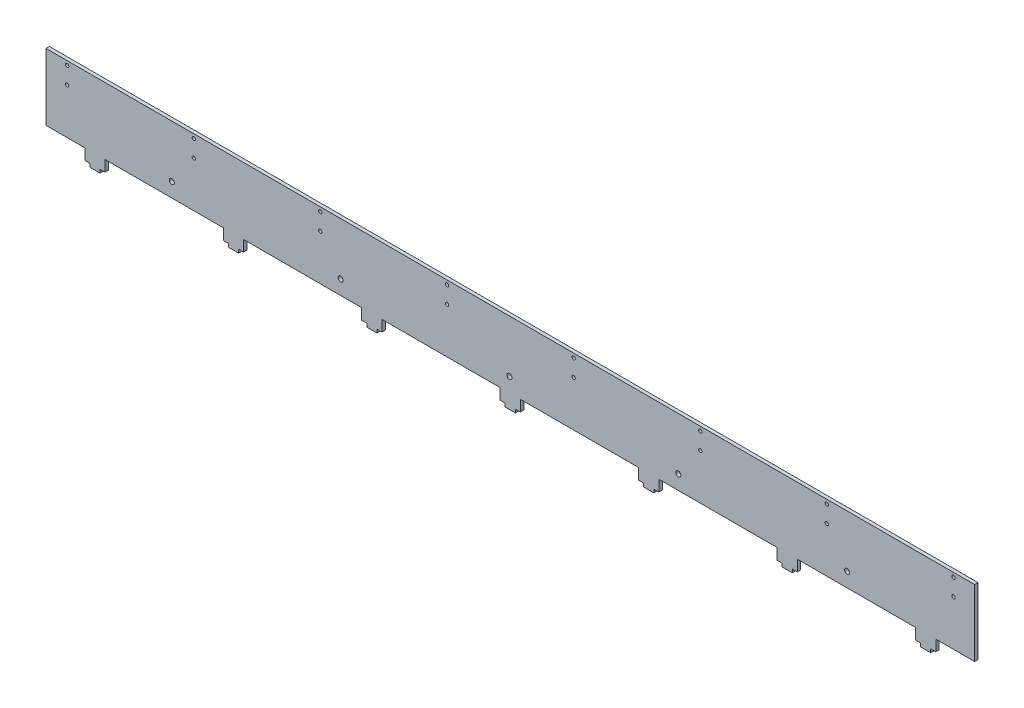
from build123d import *

# Parameters (mm, degrees)
SKETCH_1_W             = 1100
SKETCH_1_H             = 92
EXTRUDE_1_DEPTH        = 2
SKETCH_2_W             = 46
SKETCH_2_H             = 13
SKETCH_2_W_2           = 140
CUT_EXTRUDE_1_DEPTH    = 552.934778756
SKETCH_3_R             = 2
CUT_EXTRUDE_2_DEPTH    = 552.934778756
PATTERN_LINEAR_1_COUNT = 8
PATTERN_LINEAR_1_PITCH = 150
SKETCH_4_R             = 3
CUT_EXTRUDE_3_DEPTH    = 552.934778756
PATTERN_LINEAR_2_COUNT = 5
PATTERN_LINEAR_2_PITCH = 200
SKETCH_5_W             = 12
SKETCH_5_H             = 4
EXTRUDE_2_DEPTH        = 4


with BuildPart() as part:
    # Эскиз1 → Бобышка-Вытянуть1 (new, symmetric)
    with BuildSketch(Plane.XY):
        Rectangle(SKETCH_1_W, SKETCH_1_H)
    extrude(amount=EXTRUDE_1_DEPTH, both=True)

    # Эскиз2 → Вырез-Вытянуть1 (cut, through all)
    with BuildSketch(Plane.XY.offset(2)):
        with Locations((-527, -39.5)):
            Rectangle(SKETCH_2_W, SKETCH_2_H)
        with Locations((527, -39.5)):
            Rectangle(SKETCH_2_W, SKETCH_2_H)
        with Locations((-410, -39.5)):
            Rectangle(SKETCH_2_W_2, SKETCH_2_H)
        with Locations((-246, -39.5)):
            Rectangle(SKETCH_2_W_2, SKETCH_2_H)
        with Locations((-82, -39.5)):
            Rectangle(SKETCH_2_W_2, SKETCH_2_H)
        with Locations((82, -39.5)):
            Rectangle(SKETCH_2_W_2, SKETCH_2_H)
        with Locations((246, -39.5)):
            Rectangle(SKETCH_2_W_2, SKETCH_2_H)
        with Locations((410, -39.5)):
            Rectangle(SKETCH_2_W_2, SKETCH_2_H)
    extrude(amount=-CUT_EXTRUDE_1_DEPTH, mode=Mode.SUBTRACT)

    # Эскиз3 → Вырез-Вытянуть2 (cut, through all)
    with BuildSketch(Plane.XY.offset(2)):
        with Locations((-525, 41)):
            Circle(SKETCH_3_R)
        with Locations((-525, 21)):
            Circle(SKETCH_3_R)
    cut_extrude_2 = extrude(amount=-CUT_EXTRUDE_2_DEPTH, mode=Mode.SUBTRACT)

    # Линейный массив1: Вырез-Вытянуть2 ×8
    with Locations(*[(i * PATTERN_LINEAR_1_PITCH, 0, 0) for i in range(1, PATTERN_LINEAR_1_COUNT)]):
        add(cut_extrude_2, mode=Mode.SUBTRACT)

    # Эскиз4 → Вырез-Вытянуть3 (cut, through all)
    with BuildSketch(Plane(origin=(0, 0, -2), x_dir=(-1, 0, 0), z_dir=(0, 0, -1))):
        with Locations((-399, -16)):
            Circle(SKETCH_4_R)
    cut_extrude_3 = extrude(amount=-CUT_EXTRUDE_3_DEPTH, mode=Mode.SUBTRACT)

    # Линейный массив2: Вырез-Вытянуть3 ×5
    with Locations(*[(-i * PATTERN_LINEAR_2_PITCH, 0, 0) for i in range(1, PATTERN_LINEAR_2_COUNT)]):
        add(cut_extrude_3, mode=Mode.SUBTRACT)

    # Эскиз5 → Бобышка-Вытянуть2 (add)
    with BuildSketch(Plane.XZ.offset(46)):
        with Locations((492, 0)):
            Rectangle(SKETCH_5_W, SKETCH_5_H)
        with Locations((328, 0)):
            Rectangle(SKETCH_5_W, SKETCH_5_H)
        with Locations((164, 0)):
            Rectangle(SKETCH_5_W, SKETCH_5_H)
        Rectangle(SKETCH_5_W, SKETCH_5_H)
        with Locations((-492, 0)):
            Rectangle(SKETCH_5_W, SKETCH_5_H)
        with Locations((-328, 0)):
            Rectangle(SKETCH_5_W, SKETCH_5_H)
        with Locations((-164, 0)):
            Rectangle(SKETCH_5_W, SKETCH_5_H)
    extrude(amount=EXTRUDE_2_DEPTH)


solid = part.part
